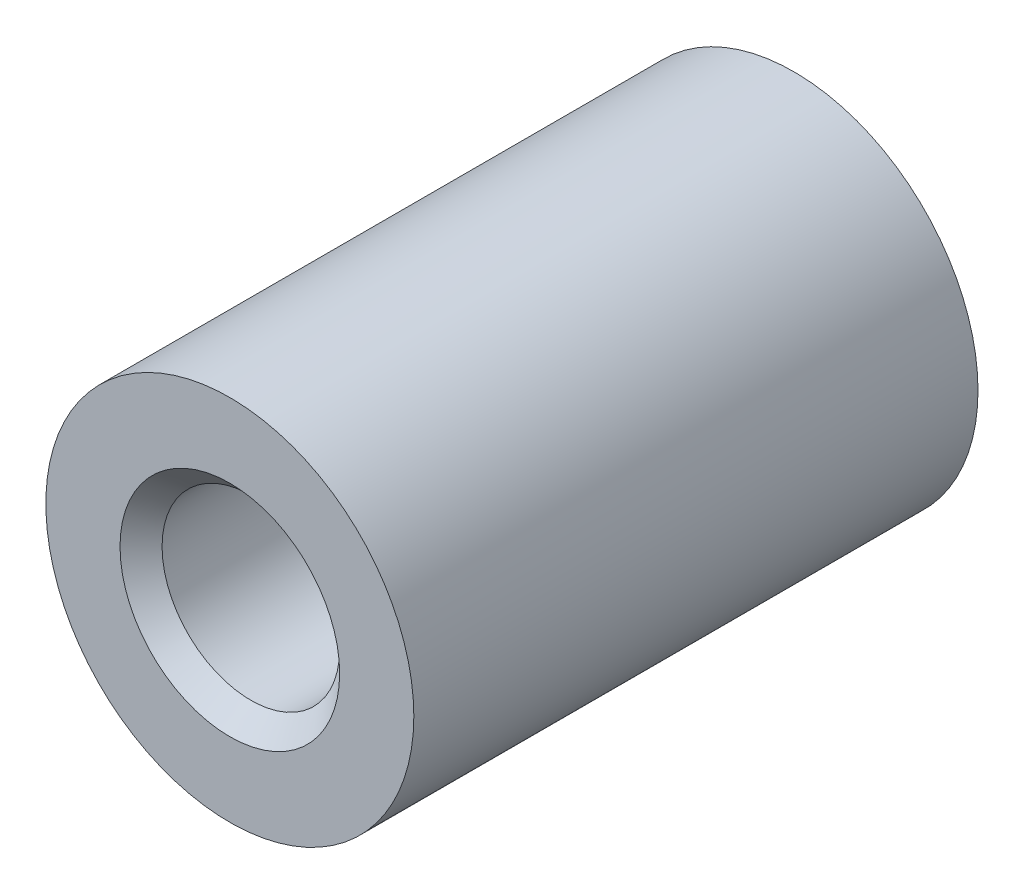
from build123d import *

# Parameters (mm, degrees)
SKETCH1_R           = 6.04
BOSS_EXTRUDE1_DEPTH = 18.52
SKETCH2_R           = 2.405
CUT_EXTRUDE1_DEPTH  = 18.52
SKETCH3_R           = 2.915
CUT_EXTRUDE2_DEPTH  = 18.52
CHAMFER1_SIZE       = 0.69
CHAMFER2_SIZE       = 0.69


with BuildPart() as part:
    # Sketch1 → Boss-Extrude1 (new body)
    with BuildSketch(Plane.XY):
        Circle(SKETCH1_R)
    extrude(amount=BOSS_EXTRUDE1_DEPTH)

    # Sketch2 → Cut-Extrude1 (cut)
    with BuildSketch(Plane.XY.offset(18.52)):
        Circle(SKETCH2_R)
    extrude(amount=-CUT_EXTRUDE1_DEPTH, mode=Mode.SUBTRACT)

    # Sketch3 → Cut-Extrude2 (cut)
    with BuildSketch(Plane.XY.offset(18.52)):
        Circle(SKETCH3_R)
    extrude(amount=-CUT_EXTRUDE2_DEPTH, mode=Mode.SUBTRACT)

    # Chamfer1
    chamfer1_edges = [part.edges().sort_by_distance(p)[0] for p in [
        (-2.915, 0, 18.52),
    ]]
    chamfer(chamfer1_edges, length=CHAMFER1_SIZE)

    # Chamfer2
    chamfer2_edges = [part.edges().sort_by_distance(p)[0] for p in [
        (-2.915, 0, 0),
    ]]
    chamfer(chamfer2_edges, length=CHAMFER2_SIZE)


solid = part.part
